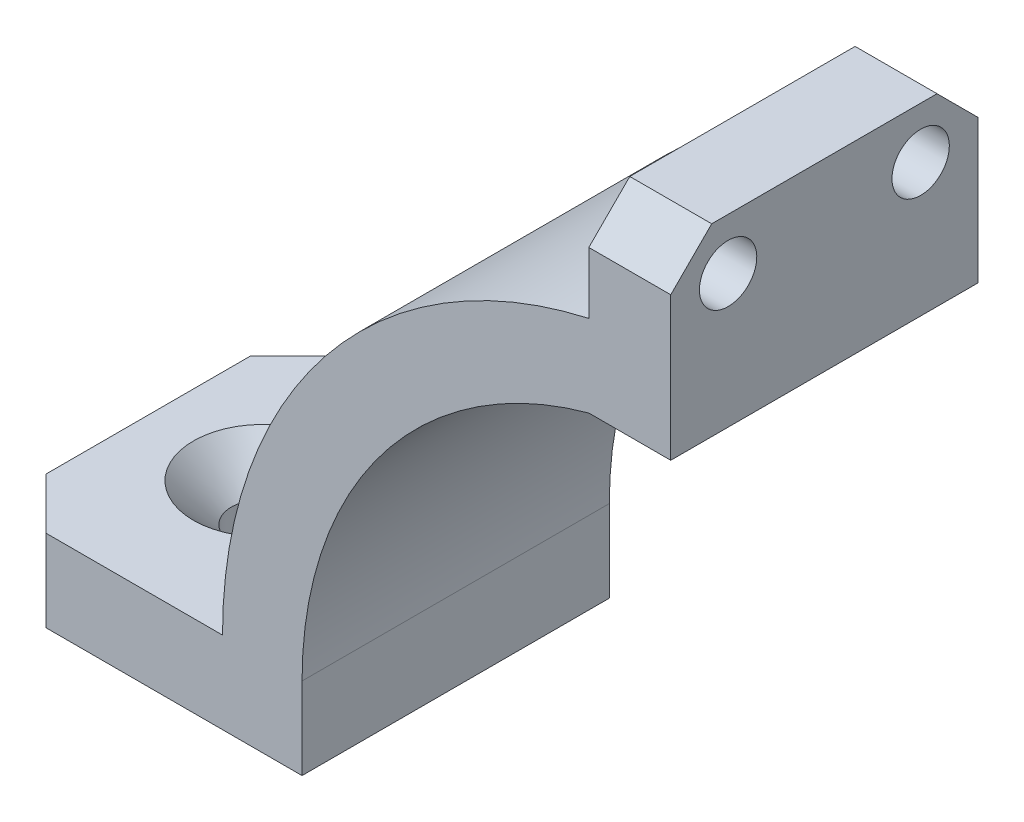
from build123d import *

# Parameters (mm, degrees)
BOSS_EXTRUDE1_DEPTH           = 15
CHAMFER1_SIZE                 = 2.5
SKETCH2_R                     = 1.4
CUT_EXTRUDE1_DEPTH            = 15
CHAMFER2_SIZE                 = 2
SKETCH3_R                     = 1.4
CUT_EXTRUDE2_DEPTH            = 47.129659115
CSK_FOR_M3_SFHCS1_D           = 3
CSK_FOR_M3_SFHCS1_DEPTH       = 31.098709071
CSK_FOR_M3_SFHCS1_CSINK_D     = 6.72
CSK_FOR_M3_SFHCS1_CSINK_ANGLE = 90
CSK_FOR_M3_SFHCS1_TIP         = 0.901290929


with BuildPart() as part:
    # Sketch1 → Boss-Extrude1 (new body)
    with BuildSketch(Plane.XY):
        with BuildLine():
            Line((-19, 0), (-19, -4))
            Line((-19, -4), (-34, -4))
            Line((-34, -4), (-34, 0))
            Line((-34, 0), (-22.883234523, 0))
            ThreePointArc((-22.883234523, 0), (-17.861391251, 14.304304416), (-5, 22.33030278))
            Line((-5, 22.33030278), (-5, 27.33030278))
            Line((-5, 27.33030278), (-1, 27.33030278))
            Line((-1, 27.33030278), (-1, 18.33030278))
            Line((-1, 18.33030278), (-5, 18.33030278))
            ThreePointArc((-5, 18.33030278), (-15.099668871, 11.532562595), (-19, 0))
        make_face()
    extrude(amount=BOSS_EXTRUDE1_DEPTH)

    # Chamfer1
    chamfer1_edges = [part.edges().sort_by_distance(p)[0] for p in [
        (-34, -2, 0),
        (-34, -2, 15),
    ]]
    chamfer(chamfer1_edges, length=CHAMFER1_SIZE)

    # Sketch2 → Cut-Extrude1 (cut)
    with BuildSketch(Plane.ZY.offset(5)):
        with Locations(Location((2.8, 24.83030278, 0), (0, 0, 270))):
            Circle(SKETCH2_R)
        with Locations(Location((12.2, 24.83030278, 0), (0, 0, 270))):
            Circle(SKETCH2_R)
    extrude(amount=-CUT_EXTRUDE1_DEPTH, mode=Mode.SUBTRACT)

    # Chamfer2
    chamfer2_edges = [part.edges().sort_by_distance(p)[0] for p in [
        (-3, 27.33030278, 0),
        (-3, 27.33030278, 15),
    ]]
    chamfer(chamfer2_edges, length=CHAMFER2_SIZE)

    # Sketch3 → Cut-Extrude2 (cut, through all)
    with BuildSketch(Plane(origin=(0, 0, 0), x_dir=(1, 0, 0), z_dir=(0, 1, 0))):
        with Locations(Location((-28.441617262, -7.5, 0), (0, 0, 270))):
            Circle(SKETCH3_R)
    extrude(amount=-CUT_EXTRUDE2_DEPTH, mode=Mode.SUBTRACT)

    # CSK for M3 SFHCS1
    with Locations(Plane(origin=(-28.441617262, 0, 7.5), x_dir=(0, 0, 1), z_dir=(0, 1, 0))):
        with Locations((0, 0)):
            CounterSinkHole(CSK_FOR_M3_SFHCS1_D / 2, CSK_FOR_M3_SFHCS1_CSINK_D / 2, depth=CSK_FOR_M3_SFHCS1_DEPTH, counter_sink_angle=CSK_FOR_M3_SFHCS1_CSINK_ANGLE)
            with Locations((0, 0, -(CSK_FOR_M3_SFHCS1_DEPTH + CSK_FOR_M3_SFHCS1_TIP / 2))):  # 118° drill point
                Cone(0, CSK_FOR_M3_SFHCS1_D / 2, CSK_FOR_M3_SFHCS1_TIP, mode=Mode.SUBTRACT)


solid = part.part
